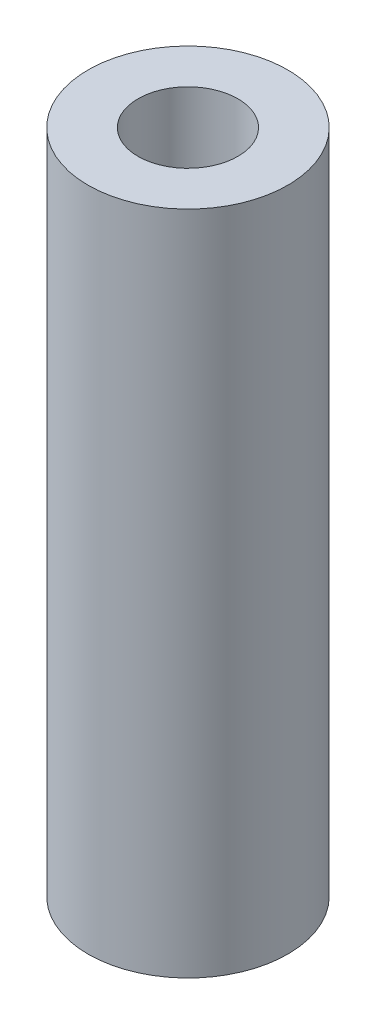
from build123d import *

# Parameters (mm, degrees)
SZKIC1_R                    = 3
SZKIC1_R_2                  = 1.5
DODANIE_WYCI_GNI_CIE1_DEPTH = 20


with BuildPart() as part:
    # Szkic1 → Dodanie-wyciągnięcie1 (new body)
    with BuildSketch(Plane(origin=(0, 0, 0), x_dir=(1, 0, 0), z_dir=(0, 1, 0))):
        with Locations(Location((0, 0, 0), (0, 0, 270))):
            Circle(SZKIC1_R)
        with Locations(Location((0, 0, 0), (0, 0, 270))):
            Circle(SZKIC1_R_2, mode=Mode.SUBTRACT)
    extrude(amount=DODANIE_WYCI_GNI_CIE1_DEPTH)


solid = part.part
